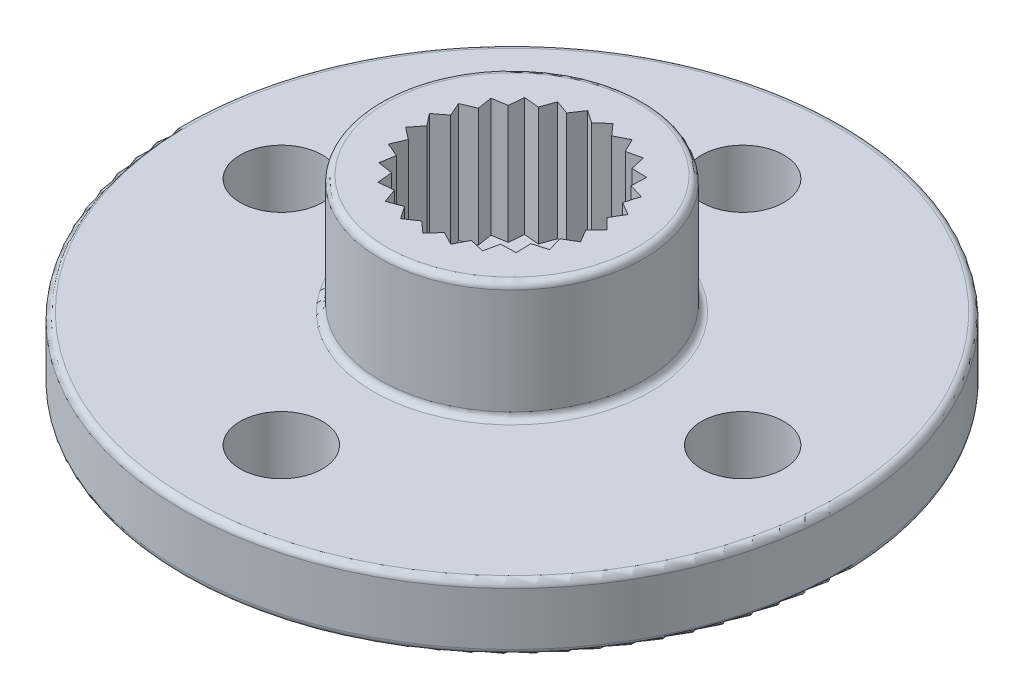
from build123d import *

# Parameters (mm, degrees)
SKETCH2_R             = 10
BOSS_EXTRUDE1_DEPTH   = 2
SKETCH3_R             = 4
BOSS_EXTRUDE2_DEPTH   = 3.6
M3X0_5_TAPPED_HOLE1_D = 2.5
SKETCH6_R             = 2.585
CUT_EXTRUDE1_DEPTH    = 3.6
SKETCH7_R             = 1.5
CUT_EXTRUDE2_DEPTH    = 15.593149078
FILLET1_R             = 0.2
CUT_EXTRUDE6_DEPTH    = 3.6
CIRPATTERN1_COUNT     = 25
CHAMFER1_SIZE         = 0.5


with BuildPart() as part:
    # Sketch2 → Boss-Extrude1 (new body)
    with BuildSketch(Plane(origin=(0, 0, 0), x_dir=(1, 0, 0), z_dir=(0, 1, 0))):
        with Locations(Location((0, 0, 0), (0, 0, 270))):
            Circle(SKETCH2_R)
    extrude(amount=BOSS_EXTRUDE1_DEPTH)

    # Sketch3 → Boss-Extrude2 (add)
    with BuildSketch(Plane(origin=(0, 2, 0), x_dir=(1, 0, 0), z_dir=(0, 1, 0))):
        with Locations(Location((0, 0, 0), (0, 0, 270))):
            Circle(SKETCH3_R)
    extrude(amount=BOSS_EXTRUDE2_DEPTH)

    # M3x0.5 Tapped Hole1 (through all)
    with Locations(Plane(origin=(0, 2, 0), x_dir=(1, 0, 0), z_dir=(0, 1, 0))):
        with Locations((0, 7), (-7, 0), (0, -7), (7, 0)):
            Hole(M3X0_5_TAPPED_HOLE1_D / 2)

    # Sketch6 → Cut-Extrude1 (cut)
    with BuildSketch(Plane(origin=(0, 5.6, 0), x_dir=(1, 0, 0), z_dir=(0, 1, 0))):
        with Locations(Location((0, 0, 0), (0, 0, 270))):
            Circle(SKETCH6_R)
    extrude(amount=-CUT_EXTRUDE1_DEPTH, mode=Mode.SUBTRACT)

    # Sketch7 → Cut-Extrude2 (cut, through all)
    with BuildSketch(Plane(origin=(0, 2, 0), x_dir=(1, 0, 0), z_dir=(0, 1, 0))):
        with Locations(Location((0, 0, 0), (0, 0, 270))):
            Circle(SKETCH7_R)
    extrude(amount=-CUT_EXTRUDE2_DEPTH, mode=Mode.SUBTRACT)

    # Fillet1
    fillet1_edges = [part.edges().sort_by_distance(p)[0] for p in [
        (0, 0, -10),
        (0, 2, -10),
        (0, 2, -4),
        (0, 5.6, -4),
    ]]
    fillet(fillet1_edges, radius=FILLET1_R)

    # Sketch8 → Cut-Extrude6 (cut)
    with BuildSketch(Plane(origin=(0, 5.6, 0), x_dir=(1, 0, 0), z_dir=(0, 1, 0))):
        with BuildLine():
            Line((2.564616503, 0.323986409), (2.89, 0))
            Line((2.89, 0), (2.564616503, -0.323986409))
            ThreePointArc((2.564616503, -0.323986409), (2.585, 0), (2.564616503, 0.323986409))
        make_face()
    cut_extrude6 = extrude(amount=-CUT_EXTRUDE6_DEPTH, mode=Mode.SUBTRACT)

    # CirPattern1: Cut-Extrude6 ×25 about axis
    cirpattern1_axis = Axis((0, 0, 0), (0, 1, 0))
    for i in range(1, CIRPATTERN1_COUNT):
        add(cut_extrude6.rotate(cirpattern1_axis, i * 360 / CIRPATTERN1_COUNT), mode=Mode.SUBTRACT)

    # Chamfer1
    chamfer1_edges = [part.edges().sort_by_distance(p)[0] for p in [
        (0, 0, -1.5),
    ]]
    chamfer(chamfer1_edges, length=CHAMFER1_SIZE)


solid = part.part
